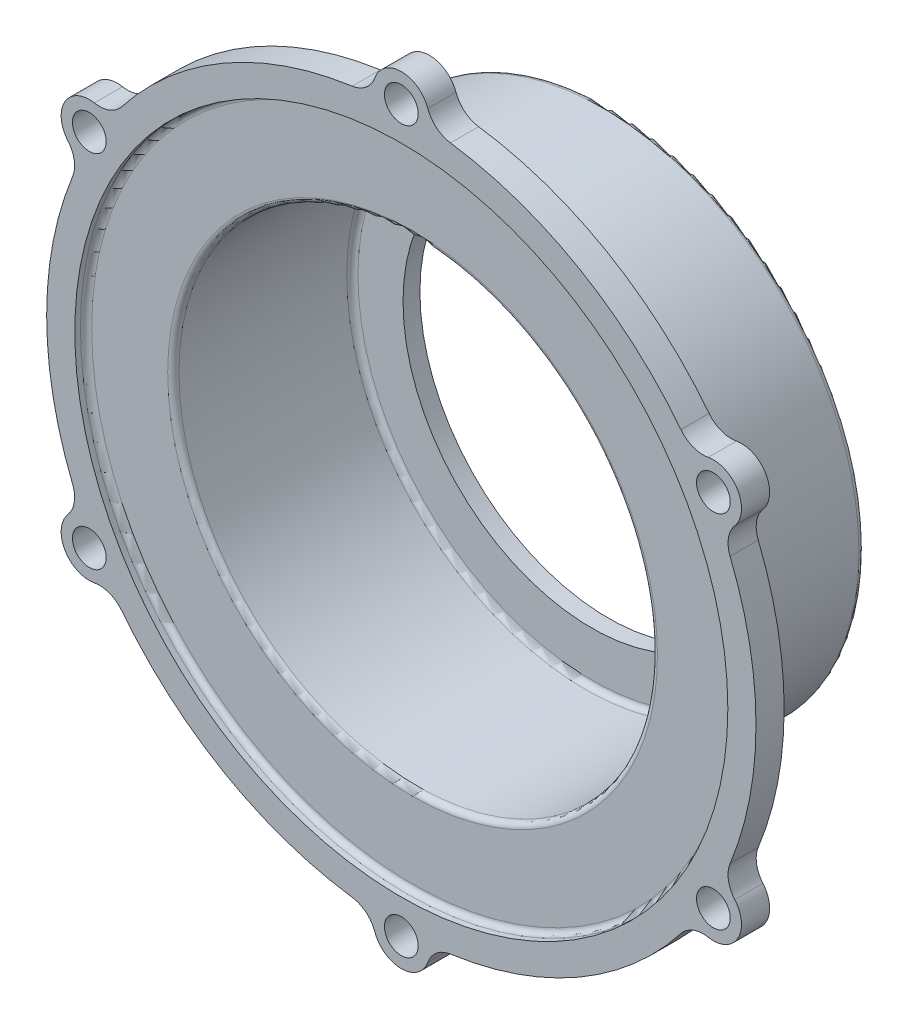
from build123d import *

# Parameters (mm, degrees)
BOSS_EXTRUDE1_DEPTH = 5
CUT_EXTRUDE1_START  = -5
SKETCH4_R           = 3
CUT_EXTRUDE1_DEPTH  = 5
FILLET1_R           = 1
FILLET3_R           = 5
CUT_EXTRUDE2_START  = -10
SKETCH6_R           = 3
CUT_EXTRUDE2_DEPTH  = 10


with BuildPart() as part:
    # Sketch2 → Revolve1 (revolve)
    with BuildSketch(Plane(origin=(0, 0, 0), x_dir=(0, 0, -1), z_dir=(1, 0, 0)), mode=Mode.PRIVATE) as revolve1_sk:
        Polygon((10.325729927, 42.5), (42.125729927, 42.5), (42.125729927, 33.5), (45.125729927, 33.5), (45.125729927, 45.5), (13.325729927, 45.5), (13.325729927, 63), (8.325729927, 63), (8.325729927, 58), (10.325729927, 58), align=None)
    revolve(revolve1_sk.sketch.rotate(Axis((0, 0, 59.953467153), (0, 0, -1)), 90), axis=Axis((0, 0, 59.953467153), (0, 0, -1)))

    # Sketch3 → Boss-Extrude1 (add)
    with BuildSketch(Plane.XY.offset(-8.325729927)):
        with BuildLine():
            ThreePointArc((-2.805546961, 62.9375), (0, 67), (2.805546961, 62.9375))
            ThreePointArc((2.805546961, 62.9375), (3.831752082, 62.883365654), (4.856937693, 62.8125))
            ThreePointArc((4.856937693, 62.8125), (0, 69), (-4.856937693, 62.8125))
            ThreePointArc((-4.856937693, 62.8125), (-3.831752082, 62.883365654), (-2.805546961, 62.9375))
        make_face()
        with BuildLine():
            ThreePointArc((-51.968751829, 35.612481426), (-59.755752861, 34.5), (-56.825689522, 27.200018574))
            ThreePointArc((-56.825689522, 27.200018574), (-54.559600438, 31.5), (-51.968751829, 35.612481426))
        make_face()
        with BuildLine():
            ThreePointArc((56.825689522, 27.200018574), (59.755752861, 34.5), (51.968751829, 35.612481426))
            ThreePointArc((51.968751829, 35.612481426), (54.559600438, 31.5), (56.825689522, 27.200018574))
        make_face()
        with BuildLine():
            ThreePointArc((-56.825689522, -27.200018574), (-59.755752861, -34.5), (-51.968751829, -35.612481426))
            ThreePointArc((-51.968751829, -35.612481426), (-54.559600438, -31.5), (-56.825689522, -27.200018574))
        make_face()
        with BuildLine():
            ThreePointArc((51.968751829, -35.612481426), (59.755752861, -34.5), (56.825689522, -27.200018574))
            ThreePointArc((56.825689522, -27.200018574), (54.559600438, -31.5), (51.968751829, -35.612481426))
        make_face()
        with BuildLine():
            ThreePointArc((-4.856937693, -62.8125), (0, -69), (4.856937693, -62.8125))
            ThreePointArc((4.856937693, -62.8125), (0, -63), (-4.856937693, -62.8125))
        make_face()
    extrude(amount=-BOSS_EXTRUDE1_DEPTH)

    # Sketch4 → Cut-Extrude1 (cut)
    with BuildSketch(Plane(origin=(0, 0, -13.325729927), x_dir=(-1, 0, 0), z_dir=(0, 0, -1)).offset(CUT_EXTRUDE1_START)):
        with Locations(Location((0, 64, 0), (0, 0, 180))):
            Circle(SKETCH4_R)
    extrude(amount=CUT_EXTRUDE1_DEPTH, mode=Mode.SUBTRACT)

    # Fillet1
    fillet1_edges = [part.edges().sort_by_distance(p)[0] for p in [
        (-45.5, 0, -45.125729927),
        (-45.5, 0, -13.325729927),
        (-58, 0, -10.325729927),
        (-42.5, 0, -10.325729927),
        (-42.5, 0, -42.125729927),
    ]]
    fillet(fillet1_edges, radius=FILLET1_R)

    # Fillet3
    fillet3_edges = [part.edges().sort_by_distance(p)[0] for p in [
        (-56.825689522, -27.200018574, -10.825729927),
        (-51.968751829, -35.612481426, -10.825729927),
        (-4.856937693, -62.8125, -10.825729927),
        (4.856937693, -62.8125, -10.825729927),
        (51.968751829, -35.612481426, -10.825729927),
        (56.825689522, -27.200018574, -10.825729927),
        (56.825689522, 27.200018574, -10.825729927),
        (51.968751829, 35.612481426, -10.825729927),
        (4.856937693, 62.8125, -10.825729927),
        (-4.856937693, 62.8125, -10.825729927),
        (-51.968751829, 35.612481426, -10.825729927),
        (-56.825689522, 27.200018574, -10.825729927),
    ]]
    fillet(fillet3_edges, radius=FILLET3_R)

    # Sketch6 → Cut-Extrude2 (cut)
    with BuildSketch(Plane(origin=(0, 0, -13.325729927), x_dir=(-1, 0, 0), z_dir=(0, 0, -1)).offset(CUT_EXTRUDE2_START)):
        with Locations(Location((0, 64, 0), (0, 0, 180))):
            Circle(SKETCH6_R)
        with Locations((55.425625842, 32)):
            Circle(SKETCH6_R)
        with Locations((55.425625842, -32)):
            Circle(SKETCH6_R)
        with Locations((0, -64)):
            Circle(SKETCH6_R)
        with Locations((-55.425625842, -32)):
            Circle(SKETCH6_R)
        with Locations((-55.425625842, 32)):
            Circle(SKETCH6_R)
    extrude(amount=CUT_EXTRUDE2_DEPTH, mode=Mode.SUBTRACT)


solid = part.part
